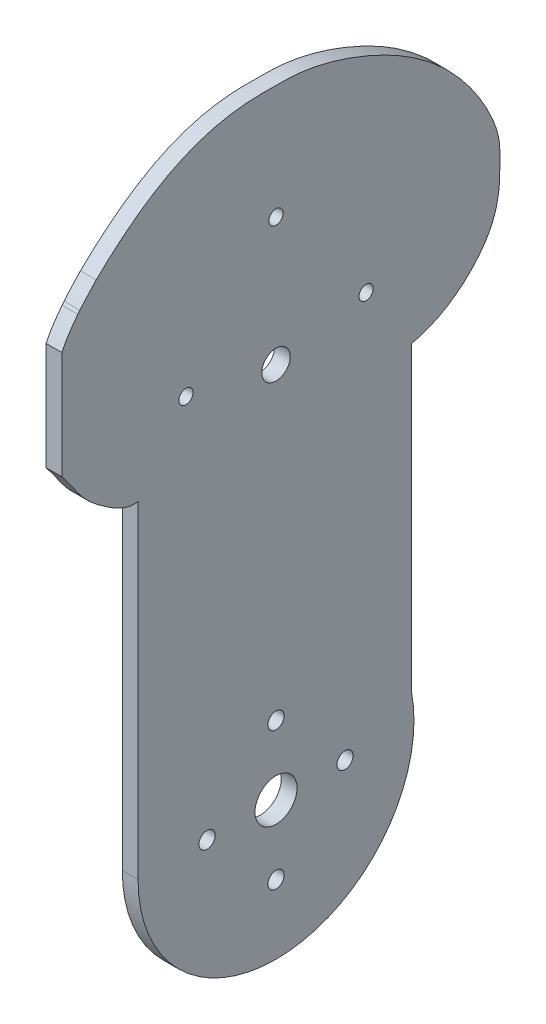
from build123d import *

# Parameters (mm, degrees)
ESQUISSE1_R        = 1.55
ESQUISSE1_R_2      = 4
ESQUISSE1_R_3      = 1.35255
ESQUISSE1_R_4      = 2.7051
BOSS_EXTRU_1_DEPTH = 3


with BuildPart() as part:
    # Esquisse1 → Boss.-Extru.1 (new body)
    with BuildSketch(Plane(origin=(0, 0, 0), x_dir=(0, 0, -1), z_dir=(1, 0, 0))):
        with BuildLine():
            Line((-40.60825, -12.7), (-40.60825, -16.144875))
            Line((-40.60825, -16.144875), (-40.60825, -16.348305132))
            add(Edge.make_bspline(
                [(-40.60825, -16.348305132), (-40.365634485, -16.661193605), (-40.112338127, -16.96547542), (-39.63020507, -17.593748723), (-39.400688032, -17.917191992), (-38.719045939, -18.893089111), (-38.271947044, -19.549593057), (-37.338540998, -20.831006808), (-36.855460104, -21.458516341), (-36.059725811, -22.342477591), (-35.781944124, -22.627029047), (-35.202868212, -23.17718548), (-34.900674383, -23.443503751), (-33.971943166, -24.212706181), (-33.324405882, -24.685383849), (-32.010805282, -25.604549776), (-31.348089528, -26.055770333), (-30.303090708, -26.660610546), (-29.948270215, -26.848696892), (-29.222483721, -27.184971005), (-28.851412004, -27.333773538), (-28.083597976, -27.570691368), (-27.685315555, -27.657976057), (-27.090666934, -27.715403346), (-26.891908645, -27.722631025), (-26.592836888, -27.712936491), (-26.492990431, -27.706278992), (-26.292963936, -27.685632014), (-26.192732932, -27.670522326), (-26.092449031, -27.65425)],
                knots=[0, 0, 0, 0, 0.0625, 0.0625, 0.125, 0.125, 0.25, 0.25, 0.375, 0.375, 0.4375, 0.4375, 0.5, 0.5, 0.625, 0.625, 0.75, 0.75, 0.8125, 0.8125, 0.875, 0.875, 0.9375, 0.9375, 0.96875, 0.96875, 0.984375, 0.984375, 1, 1, 1, 1], degree=3))
            Line((-26.092449031, -27.65425), (-26.092449031, -90))
            ThreePointArc((-26.092449031, -90), (2.64551669, -116.14013034), (25.954024412, -85.06135051))
            Line((25.954024412, -85.06135051), (25.954024412, -27.65425))
            add(Edge.make_bspline(
                [(25.954024412, -27.65425), (27.179118802, -27.419536533), (28.353377808, -27.051803075), (30.05705383, -26.34918771), (30.615126485, -26.089288473), (31.712904721, -25.521429223), (32.254485024, -25.212118815), (33.827204106, -24.230350536), (34.814025463, -23.502087852), (36.672007358, -21.907218093), (37.543320305, -21.040793316), (38.751902771, -19.623473398), (39.134714509, -19.134962989), (39.851014333, -18.131439591), (40.185535135, -17.615291382), (40.801362362, -16.550595558), (41.082635497, -16.002027673), (41.457015911, -15.150237789), (41.574249194, -14.86042264), (41.789713906, -14.277065554), (41.888049248, -13.98351322), (42.334688534, -12.506770959), (42.546239761, -11.296312151), (42.717568356, -9.451511475), (42.750611649, -8.83067761), (42.772859866, -7.900507946), (42.775360474, -7.590422151), (42.77555993, -6.970221998), (42.772087252, -6.66010067), (42.772087252, -6.35)],
                knots=[0, 0, 0, 0, 0.125, 0.125, 0.1875, 0.1875, 0.25, 0.25, 0.375, 0.375, 0.5, 0.5, 0.5625, 0.5625, 0.625, 0.625, 0.6875, 0.6875, 0.71875, 0.71875, 0.75, 0.75, 0.875, 0.875, 0.9375, 0.9375, 0.96875, 0.96875, 1, 1, 1, 1], degree=3))
            add(Edge.make_bspline(
                [(42.772087252, -6.35), (42.772087252, -5.874878454), (42.783792207, -5.398095979), (42.789657917, -4.447020546), (42.781867467, -3.973004463), (42.672546396, -2.563152451), (42.499179213, -1.637510108), (42.106282017, -0.267897459), (41.954068536, 0.185625042), (41.614819435, 1.087728793), (41.430081297, 1.530283034), (40.844911495, 2.839259084), (40.416604561, 3.689518781), (39.046783283, 6.190525131), (38.013123304, 7.787251584), (36.291657446, 10.082106977), (35.688509547, 10.830664164), (34.43654182, 12.281738953), (33.786199883, 12.985690235), (33.112075, 13.668565083)],
                knots=[0, 0, 0, 0, 0.0625, 0.0625, 0.125, 0.125, 0.25, 0.25, 0.3125, 0.3125, 0.375, 0.375, 0.5, 0.5, 0.75, 0.75, 0.875, 0.875, 1, 1, 1, 1], degree=3))
            add(Edge.make_bspline(
                [(33.112075, 13.668565083), (32.332207955, 14.539101946), (31.435060987, 15.277734234)],
                knots=[0, 0, 0, 1, 1, 1], degree=2))
            add(Edge.make_bspline(
                [(31.435060987, 15.277734234), (30.299691041, 16.309376592), (29.113704516, 17.275445235), (26.646604831, 19.084346085), (25.360475951, 19.928267183), (21.432297769, 22.265681686), (18.70167828, 23.563722979), (14.477833082, 25.213127628), (13.049229105, 25.71486416), (10.864398428, 26.369911185), (10.129061703, 26.571832136), (8.64156399, 26.936524394), (7.890831572, 27.098844789), (5.637990782, 27.512412208), (4.127431428, 27.693727696), (2.225306731, 27.768676851), (1.844136038, 27.775542931), (1.080940786, 27.779973661), (0.698904769, 27.777413484), (-0.446346689, 27.779064109), (-1.208874123, 27.797823926), (-2.732682239, 27.815308111), (-3.492085471, 27.806304753), (-5.004084105, 27.739990771), (-5.756994671, 27.684916502), (-8.006157922, 27.451797552), (-9.492662784, 27.204583891), (-11.701987236, 26.688775277), (-12.434852331, 26.491461598), (-13.894254142, 26.051929085), (-14.622118919, 25.807493497), (-16.765417144, 25.01223388), (-18.151500369, 24.400517874), (-20.847821735, 23.032525232), (-22.158708475, 22.277484827), (-24.716496252, 20.645447351), (-25.966430559, 19.7652326), (-28.39125747, 17.919703458), (-29.567431908, 16.954258357), (-31.287557173, 15.454109034), (-31.85380584, 14.945666112), (-32.972832423, 13.91291508), (-33.52577931, 13.388805977), (-34.066096443, 12.849822171)],
                knots=[0, 0, 0, 0, 0.0625, 0.0625, 0.125, 0.125, 0.25, 0.25, 0.3125, 0.3125, 0.34375, 0.34375, 0.375, 0.375, 0.4375, 0.4375, 0.453125, 0.453125, 0.46875, 0.46875, 0.5, 0.5, 0.53125, 0.53125, 0.5625, 0.5625, 0.625, 0.625, 0.65625, 0.65625, 0.6875, 0.6875, 0.75, 0.75, 0.8125, 0.8125, 0.875, 0.875, 0.9375, 0.9375, 0.96875, 0.96875, 1, 1, 1, 1], degree=3))
            add(Edge.make_bspline(
                [(-34.066096443, 12.849822171), (-35.159801618, 11.692162737), (-36.251081621, 10.53740284), (-37.166580532, 9.404947171)],
                knots=[0, 0, 0, 0, 1, 1, 1, 1], degree=3))
            ThreePointArc((-37.166580532, 9.404947171), (-37.363014685, 9.160281042), (-37.557796616, 8.914297524))
            add(Edge.make_bspline(
                [(-37.557796616, 8.914297524), (-38.142933539, 8.170182683), (-38.709522845, 7.412667282), (-39.741912272, 5.824816801), (-40.203133529, 4.998794666), (-40.60825, 4.142494902)],
                knots=[0, 0, 0, 0, 0.5, 0.5, 1, 1, 1, 1], degree=3))
            Line((-40.60825, 4.142494902), (-40.60825, -12.7))
        make_face()
        with Locations((0.1651, -103.128774516)):
            Circle(ESQUISSE1_R, mode=Mode.SUBTRACT)
        with Locations((-12.963674516, -90)):
            Circle(ESQUISSE1_R, mode=Mode.SUBTRACT)
        with Locations((0.1651, -90)):
            Circle(ESQUISSE1_R_2, mode=Mode.SUBTRACT)
        with Locations((0.1651, -76.871225484)):
            Circle(ESQUISSE1_R, mode=Mode.SUBTRACT)
        with Locations((13.293874516, -90)):
            Circle(ESQUISSE1_R, mode=Mode.SUBTRACT)
        with Locations((-16.9799, -14.9225)):
            Circle(ESQUISSE1_R_3, mode=Mode.SUBTRACT)
        with Locations((0.1651, -18.2245)):
            Circle(ESQUISSE1_R_4, mode=Mode.SUBTRACT)
        with Locations((0.1651, 6.103472306)):
            Circle(ESQUISSE1_R_3, mode=Mode.SUBTRACT)
        with Locations((17.3101, -14.9225)):
            Circle(ESQUISSE1_R_3, mode=Mode.SUBTRACT)
    extrude(amount=BOSS_EXTRU_1_DEPTH)


solid = part.part
